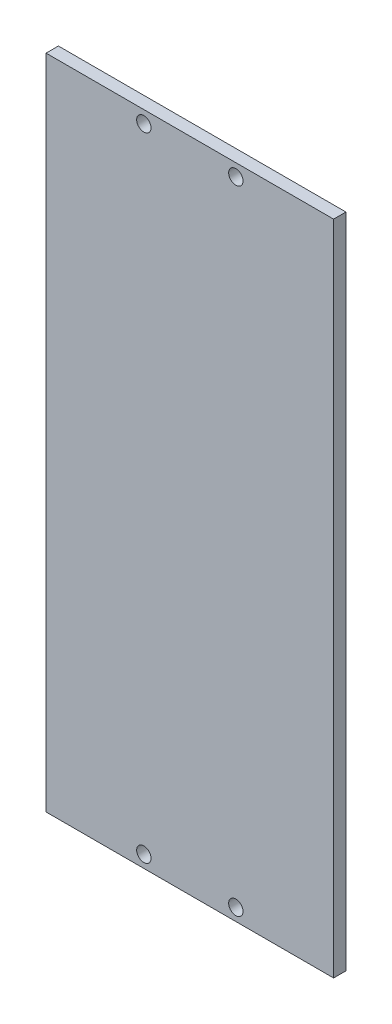
from build123d import *

# Parameters (mm, degrees)
SKETCH_1_W      = 70
SKETCH_1_H      = 160
SKETCH_1_R      = 1.75
EXTRUDE_2_DEPTH = 3


with BuildPart() as part:
    # 스케치1 → 보스-돌출2 (new body)
    with BuildSketch(Plane.XY):
        Rectangle(SKETCH_1_W, SKETCH_1_H)
        with Locations((-11.2, 77)):
            Circle(SKETCH_1_R, mode=Mode.SUBTRACT)
        with Locations((11.2, 77)):
            Circle(SKETCH_1_R, mode=Mode.SUBTRACT)
        with Locations(Location((11.2, -77, 0), (0, 0, 180))):
            Circle(SKETCH_1_R, mode=Mode.SUBTRACT)
        with Locations(Location((-11.2, -77, 0), (0, 0, 180))):
            Circle(SKETCH_1_R, mode=Mode.SUBTRACT)
    extrude(amount=EXTRUDE_2_DEPTH)


solid = part.part
